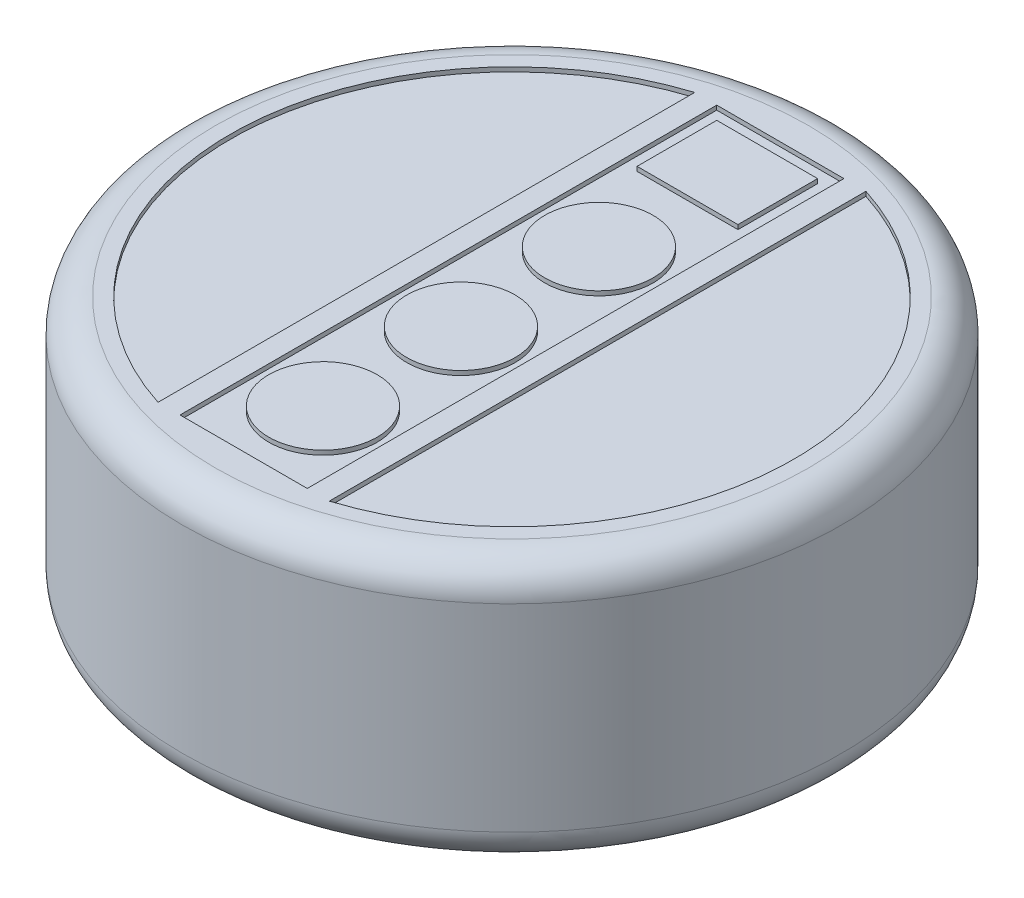
from build123d import *

# Parameters (mm, degrees)
SKETCH1_R           = 190.5
BOSS_EXTRUDE1_DEPTH = 152.4
SKETCH4_W           = 73.557387936
SKETCH4_H           = 310.235544462
CUT_EXTRUDE2_DEPTH  = 2.54
SKETCH5_R           = 31.334472959
SKETCH5_W           = 58.317387936
SKETCH5_H           = 46.041460357
BOSS_EXTRUDE3_DEPTH = 2.54
SKETCH6_W           = 25.4
SKETCH6_H           = 63.5
CUT_EXTRUDE3_DEPTH  = 38.1
FILLET3_R           = 19.05
SKETCH8_W           = 192.151300236
SKETCH8_H           = 34.488694915
CUT_EXTRUDE4_DEPTH  = 25.4


with BuildPart() as part:
    # Sketch1 → Boss-Extrude1 (new body)
    with BuildSketch(Plane(origin=(0, 0, 0), x_dir=(1, 0, 0), z_dir=(0, 1, 0))):
        with Locations(Location((0, 0, 0), (0, 0, 90))):
            Circle(SKETCH1_R)
    extrude(amount=BOSS_EXTRUDE1_DEPTH)

    # Sketch4 → Cut-Extrude2 (cut)
    with BuildSketch(Plane(origin=(0, 152.4, 0), x_dir=(1, 0, 0), z_dir=(0, 1, 0))):
        with BuildLine():
            Line((-49.478693968, 155.117772231), (-49.478693968, -155.117772231))
            ThreePointArc((-49.478693968, -155.117772231), (-162.817887281, 0), (-49.478693968, 155.117772231))
        make_face()
        with BuildLine():
            Line((49.478693968, 155.117772231), (49.478693968, -155.117772231))
            ThreePointArc((49.478693968, -155.117772231), (162.817887281, 0), (49.478693968, 155.117772231))
        make_face()
        Rectangle(SKETCH4_W, SKETCH4_H)
    extrude(amount=-CUT_EXTRUDE2_DEPTH, mode=Mode.SUBTRACT)

    # Sketch5 → Boss-Extrude3 (add)
    with BuildSketch(Plane(origin=(0, 149.86, 0), x_dir=(1, 0, 0), z_dir=(0, 1, 0))):
        with Locations(Location((0, 50.250313703, 0), (0, 0, 270))):
            Circle(SKETCH5_R)
        with Locations(Location((0, -29.505686297, 0), (0, 0, 90))):
            Circle(SKETCH5_R)
        with Locations(Location((0, -109.261686297, 0), (0, 0, 90))):
            Circle(SKETCH5_R)
        with Locations((0, 124.477042052)):
            Rectangle(SKETCH5_W, SKETCH5_H)
    extrude(amount=BOSS_EXTRUDE3_DEPTH)

    # Sketch6 → Cut-Extrude3 (cut)
    with BuildSketch(Plane.XZ):
        with Locations((-153.728334256, 2.735150341)):
            Rectangle(SKETCH6_W, SKETCH6_H)
        with Locations((152.139955728, 2.262697534)):
            Rectangle(SKETCH6_W, SKETCH6_H)
    extrude(amount=-CUT_EXTRUDE3_DEPTH, mode=Mode.SUBTRACT)

    # Fillet3
    fillet3_edges = [part.edges().sort_by_distance(p)[0] for p in [
        (0, 0, 190.5),
        (0, 152.4, 190.5),
    ]]
    fillet(fillet3_edges, radius=FILLET3_R)

    # Sketch8 → Cut-Extrude4 (cut)
    with BuildSketch(Plane.XZ):
        with Locations((0, 87.69982421)):
            Rectangle(SKETCH8_W, SKETCH8_H)
    extrude(amount=-CUT_EXTRUDE4_DEPTH, mode=Mode.SUBTRACT)


solid = part.part
